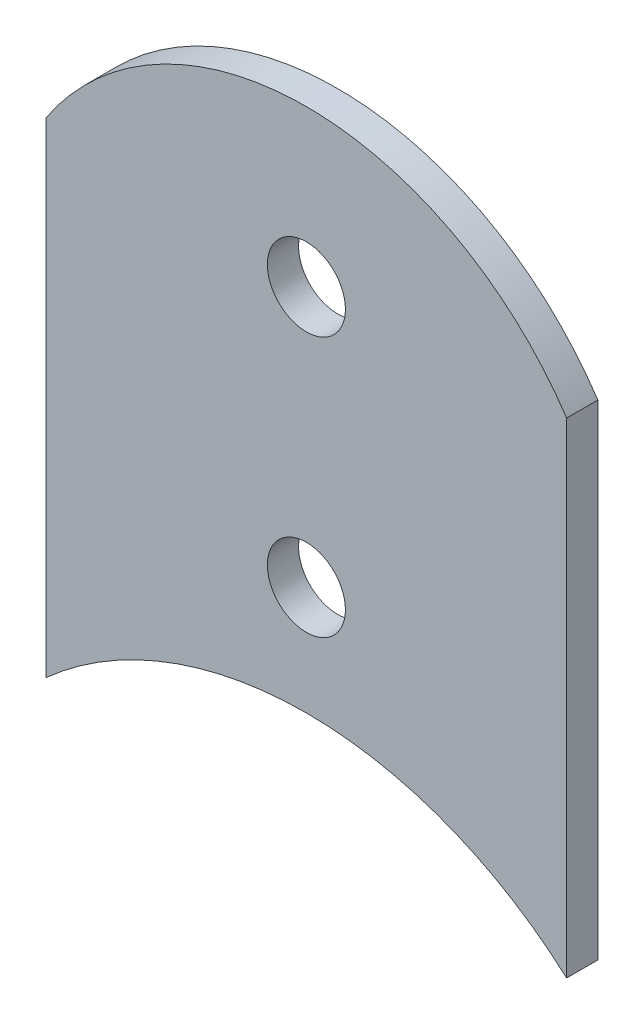
from build123d import *

# Parameters (mm, degrees)
SKIZZE1_R                       = 7.5
AUFSATZ_LINEAR_AUSTRAGEN1_DEPTH = 6


with BuildPart() as part:
    # Skizze1 → Aufsatz-Linear austragen1 (new body)
    with BuildSketch(Plane.XY):
        with BuildLine():
            Line((-50, -123.484872851), (-50, -30.318624947))
            ThreePointArc((-50, -30.318624947), (0, -3.484872851), (50, -30.318624947))
            Line((50, -30.318624947), (50, -123.484872851))
            ThreePointArc((50, -123.484872851), (0, -104.386572288), (-50, -123.484872851))
        make_face()
        with Locations((0, -83.484872851)):
            Circle(SKIZZE1_R, mode=Mode.SUBTRACT)
        with Locations((0, -33.484872851)):
            Circle(SKIZZE1_R, mode=Mode.SUBTRACT)
    extrude(amount=AUFSATZ_LINEAR_AUSTRAGEN1_DEPTH)


solid = part.part
